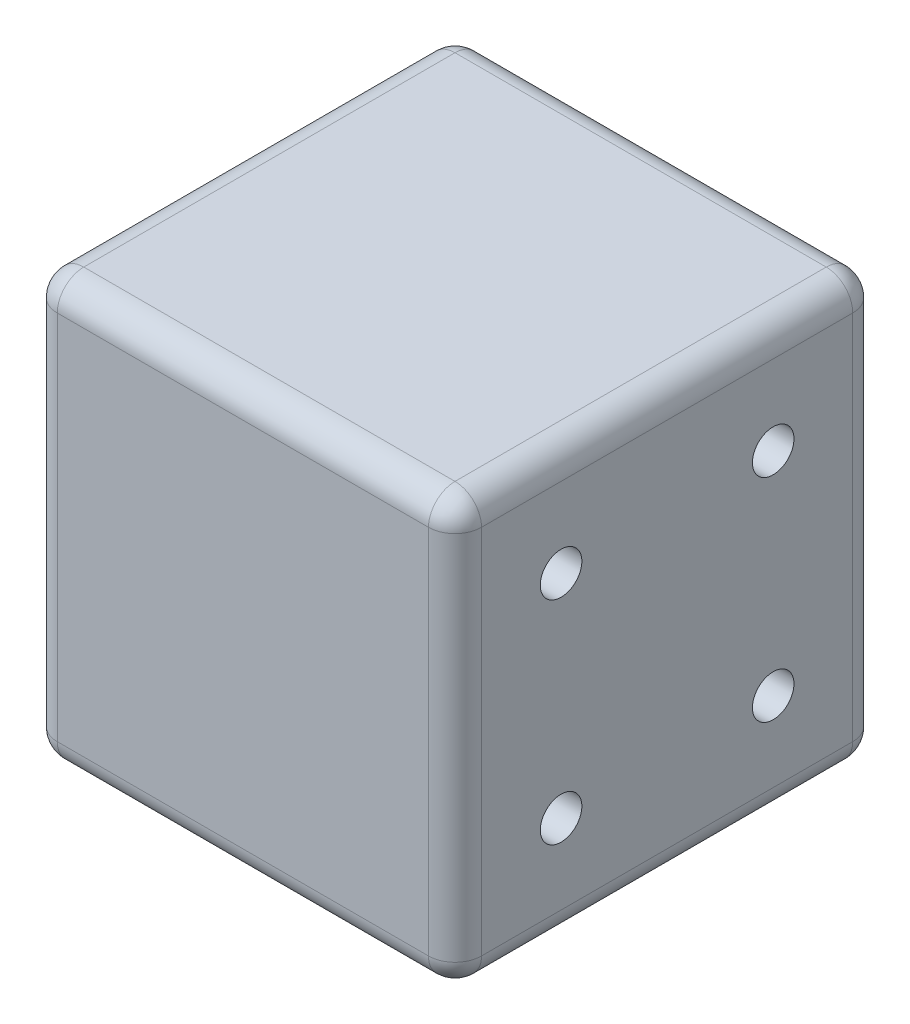
from build123d import *

# Parameters (mm, degrees)
SKETCH1_W           = 50.8
SKETCH1_H           = 50.8
BOSS_EXTRUDE1_DEPTH = 50.8
FILLET1_R           = 3.175
SKETCH2_R           = 2.4892
CUT_EXTRUDE1_DEPTH  = 88.988181024


with BuildPart() as part:
    # Sketch1 → Boss-Extrude1 (new body)
    with BuildSketch(Plane.XY):
        with Locations((25.4, 25.4)):
            Rectangle(SKETCH1_W, SKETCH1_H)
    extrude(amount=-BOSS_EXTRUDE1_DEPTH)

    # Fillet1
    fillet1_edges = [part.edges().sort_by_distance(p)[0] for p in [
        (50.8, 25.4, -50.8),
        (25.4, 50.8, -50.8),
        (0, 25.4, -50.8),
        (25.4, 50.8, 0),
        (50.8, 25.4, 0),
        (25.4, 0, 0),
        (0, 25.4, 0),
        (0, 50.8, -25.4),
        (50.8, 50.8, -25.4),
        (50.8, 0, -25.4),
        (0, 0, -25.4),
        (25.4, 0, -50.8),
    ]]
    fillet(fillet1_edges, radius=FILLET1_R)

    # Sketch2 → Cut-Extrude1 (cut, through all)
    with BuildSketch(Plane.ZY):
        with Locations((-38.1, 12.7)):
            Circle(SKETCH2_R)
        with Locations((-12.7, 12.7)):
            Circle(SKETCH2_R)
        with Locations((-12.7, 38.1)):
            Circle(SKETCH2_R)
        with Locations((-38.1, 38.1)):
            Circle(SKETCH2_R)
    extrude(amount=-CUT_EXTRUDE1_DEPTH, mode=Mode.SUBTRACT)


solid = part.part
